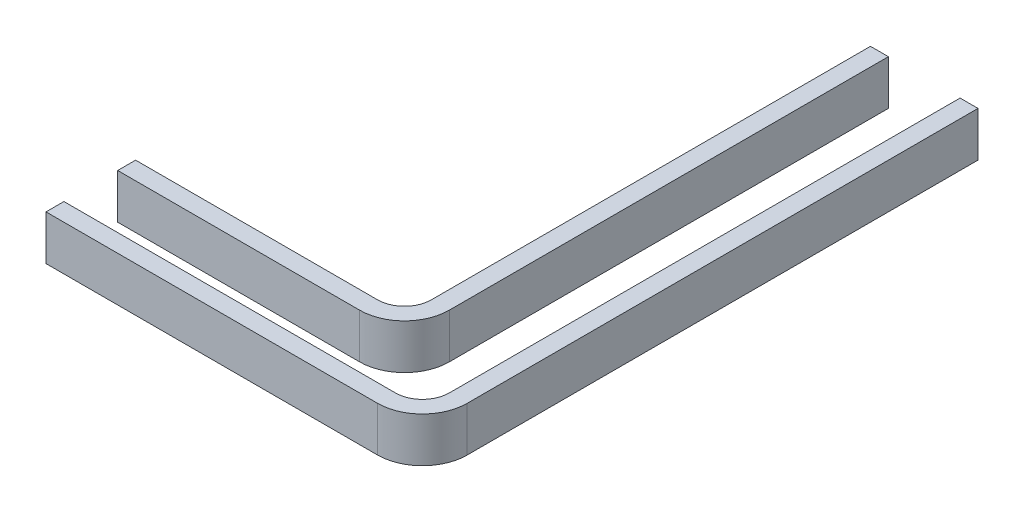
from build123d import *

# Parameters (mm, degrees)
SKETCH_1_W               = 30
SKETCH_1_H               = 2
SKETCH_1_W_2             = 2
SKETCH_1_H_2             = 52
SKETCH_1_W_3             = 12
SKETCH_1_H_3             = 3
EXTRUDE_1_DEPTH          = 5
FILLET_1_R               = 5
FILLET_2_R               = 3
CUT_EXTRUDE_1_DEPTH      = 74.409808609
CUT_EXTRUDE_1_DEPTH_BACK = 74.409808609
SKETCH_2_W               = 12
SKETCH_2_H               = 3


with BuildPart() as part:
    # 草图1 → 凸台-拉伸1 (new body)
    with BuildSketch(Plane(origin=(0, 0, 0), x_dir=(1, 0, 0), z_dir=(0, 1, 0))):
        with Locations((15, 4)):
            Rectangle(SKETCH_1_W, SKETCH_1_H)
        Polygon((0, -5), (40, -5), (40, -3), (32, -3), (30, -3), (0, -3), align=None)
        with Locations((41, -4)):
            Rectangle(SKETCH_1_W_2, SKETCH_1_H)
        Polygon((40, 3), (40, -3), (42, -3), (42, 57), (40, 57), (40, 5), align=None)
        with Locations((31, 31)):
            Rectangle(SKETCH_1_W_2, SKETCH_1_H_2)
        with Locations((31, 4)):
            Rectangle(SKETCH_1_W_2, SKETCH_1_H)
        with Locations((36, 58.5)):
            Rectangle(SKETCH_1_W_3, SKETCH_1_H_3)
    extrude(amount=EXTRUDE_1_DEPTH)

    # 圆角1
    fillet_1_edges = [part.edges().sort_by_distance(p)[0] for p in [
        (42, 2.5, 5),
        (32, 2.5, -3),
    ]]
    fillet(fillet_1_edges, radius=FILLET_1_R)

    # 圆角2
    fillet_2_edges = [part.edges().sort_by_distance(p)[0] for p in [
        (40, 2.5, 3),
        (30, 2.5, -5),
    ]]
    fillet(fillet_2_edges, radius=FILLET_2_R)

    # 草图2 → 切除-拉伸1 (cut, two sides: drawn at the far end of the back side and taken through both)
    with BuildSketch(Plane(origin=(0, 5, 0), x_dir=(1, 0, 0), z_dir=(0, 1, 0)).offset(-CUT_EXTRUDE_1_DEPTH_BACK)):
        with Locations((36, 58.5)):
            Rectangle(SKETCH_2_W, SKETCH_2_H)
    extrude(amount=CUT_EXTRUDE_1_DEPTH + CUT_EXTRUDE_1_DEPTH_BACK, mode=Mode.SUBTRACT)


with BuildPart() as cut_extrude_1_piece_1:
    # of the separate pieces the step leaves, piece 1, a body of its own (cut_extrude_1_pieces)
    add(part.part.solids().sort_by_distance((42, 5, -57))[0])


with BuildPart() as cut_extrude_1_piece_2:
    # of the separate pieces the step leaves, piece 2, a body of its own (cut_extrude_1_pieces)
    add(part.part.solids().sort_by_distance((27, 5, -5))[0])


solid = Compound([cut_extrude_1_piece_1.part, cut_extrude_1_piece_2.part])
